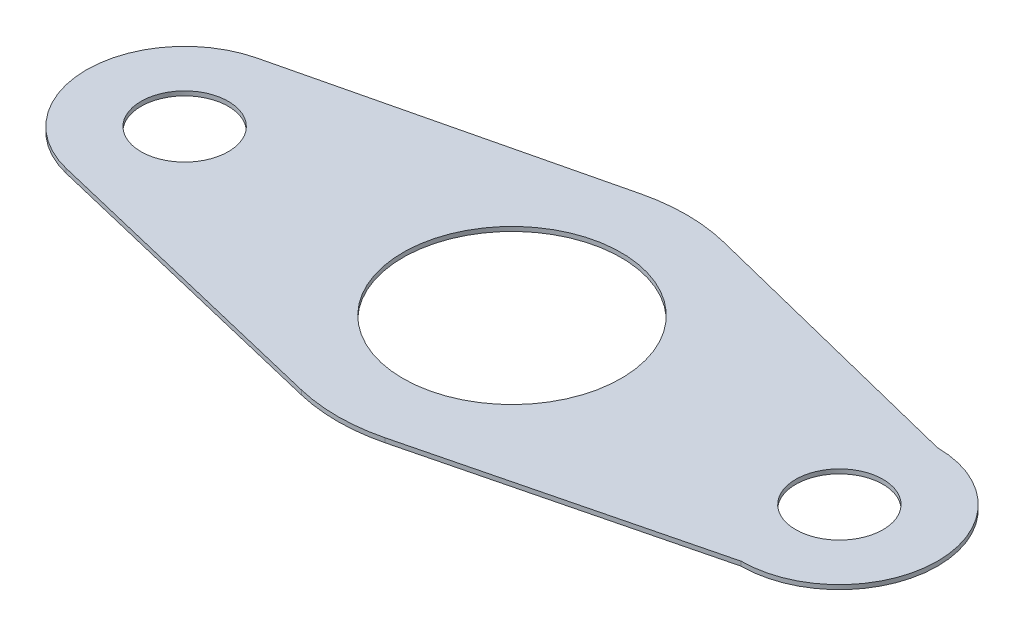
from build123d import *

# Parameters (mm, degrees)
SKETCH1_R           = 22.5
SKETCH1_R_2         = 10
SKETCH1_R_3         = 40
SKETCH1_R_4         = 25
BOSS_EXTRUDE1_DEPTH = 1


with BuildPart() as part:
    # Sketch1 → Boss-Extrude1 (new body)
    # profile 1 of 5: a face of its own
    with BuildSketch(Plane(origin=(0, 0, 0), x_dir=(1, 0, 0), z_dir=(0, 1, 0))):
        with Locations((-75, 0)):
            Circle(SKETCH1_R)
        with Locations(Location((-75, 0, 0), (0, 0, 270))):
            Circle(SKETCH1_R_2, mode=Mode.SUBTRACT)
    # profile 2 of 5: a face of its own
    with BuildSketch(Plane(origin=(0, 0, 0), x_dir=(1, 0, 0), z_dir=(0, 1, 0))):
        with BuildLine():
            ThreePointArc((-52.5, 0), (-61.069368284, -17.668828484), (-80.25, -21.878928219))
            Line((-80.25, -21.878928219), (-9.333333333, -38.895872389))
            ThreePointArc((-9.333333333, -38.895872389), (-40, 0), (-9.333333333, 38.895872389))
            Line((-9.333333333, 38.895872389), (-80.25, 21.878928219))
            ThreePointArc((-80.25, 21.878928219), (-61.069368284, 17.668828484), (-52.5, 0))
        make_face()
    # profile 3 of 5: a face of its own
    with BuildSketch(Plane(origin=(0, 0, 0), x_dir=(1, 0, 0), z_dir=(0, 1, 0))):
        Circle(SKETCH1_R_3)
        with Locations(Location((0, 0, 0), (0, 0, 270))):
            Circle(SKETCH1_R_4, mode=Mode.SUBTRACT)
    # profile 4 of 5: a face of its own
    with BuildSketch(Plane(origin=(0, 0, 0), x_dir=(1, 0, 0), z_dir=(0, 1, 0))):
        with BuildLine():
            ThreePointArc((40, 0), (31.524856574, -24.620792392), (9.6908291, -38.808347444))
            Line((9.6908291, -38.808347444), (75, -22.5))
            ThreePointArc((75, -22.5), (52.5, 0), (75, 22.5))
            Line((75, 22.5), (9.6908291, 38.808347444))
            ThreePointArc((9.6908291, 38.808347444), (31.524856574, 24.620792392), (40, 0))
        make_face()
    # profile 5 of 5: a face of its own
    with BuildSketch(Plane(origin=(0, 0, 0), x_dir=(1, 0, 0), z_dir=(0, 1, 0))):
        with Locations((75, 0)):
            Circle(SKETCH1_R)
        with Locations(Location((75, 0, 0), (0, 0, 270))):
            Circle(SKETCH1_R_2, mode=Mode.SUBTRACT)
    extrude(amount=BOSS_EXTRUDE1_DEPTH)


solid = part.part
